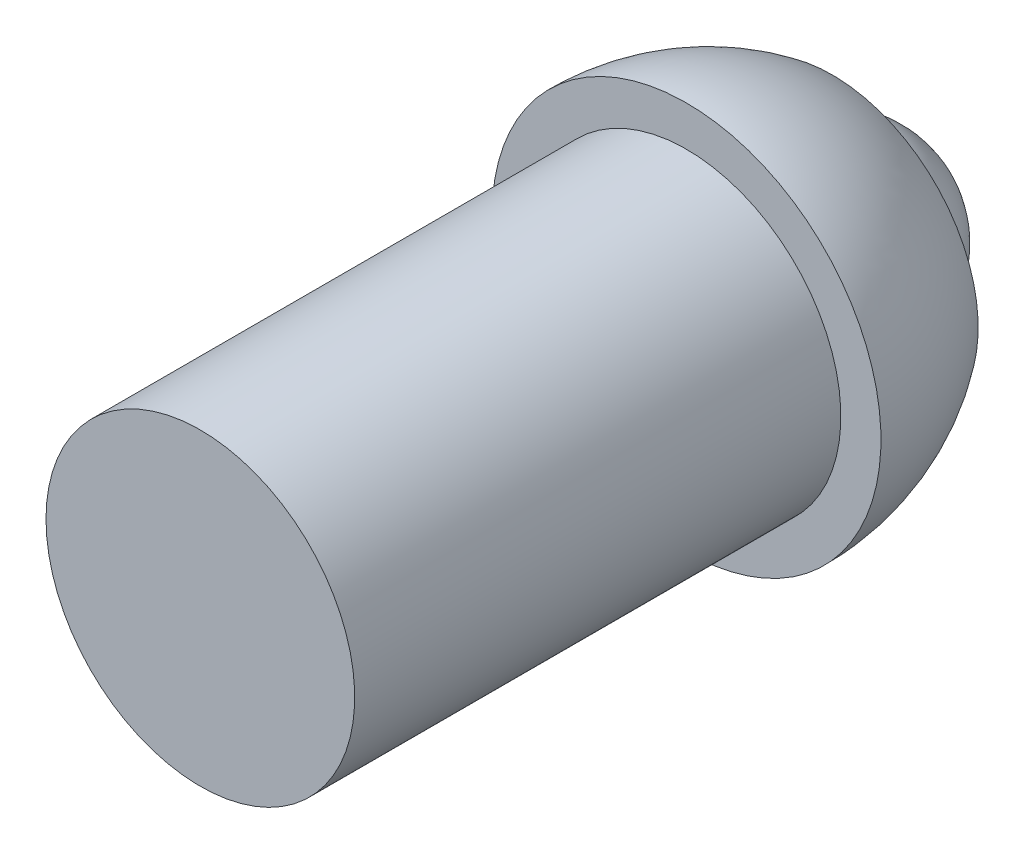
from build123d import *


with BuildPart() as part:
    # Sketch1 → Revolve1 (revolve)
    with BuildSketch(Plane(origin=(0, 0, 0), x_dir=(1, 0, 0), z_dir=(0, 1, 0)), mode=Mode.PRIVATE) as revolve1_sk:
        with BuildLine():
            Line((0, -10), (3.175, -10))
            Line((3.175, -10), (3.175, 0))
            Line((3.175, 0), (4, 0))
            ThreePointArc((4, 0), (3.74341649, 1.58113883), (3, 3))
            Line((3, 3), (2, 3))
            ThreePointArc((2, 3), (1.414213562, 4.414213562), (0, 5))
            Line((0, 5), (0, -10))
        make_face()
    revolve(revolve1_sk.sketch.rotate(Axis((0, 0, -5), (0, 0, 1)), 180), axis=Axis((0, 0, -5), (0, 0, 1)))


solid = part.part
